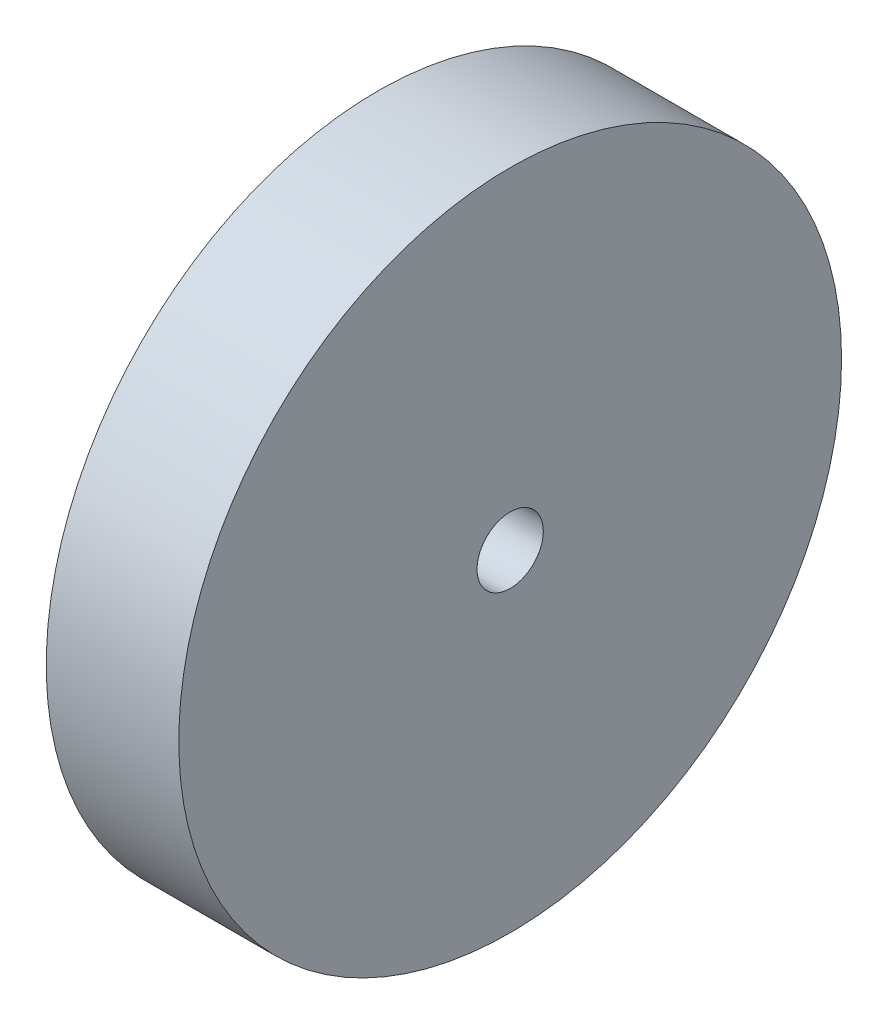
from build123d import *

# Parameters (mm, degrees)
SKETCH1_R           = 50
SKETCH1_R_2         = 5
BOSS_EXTRUDE1_DEPTH = 20


with BuildPart() as part:
    # Sketch1 → Boss-Extrude1 (new body)
    with BuildSketch(Plane(origin=(0, 0, 0), x_dir=(0, 0, -1), z_dir=(1, 0, 0))):
        Circle(SKETCH1_R)
        Circle(SKETCH1_R_2, mode=Mode.SUBTRACT)
    extrude(amount=BOSS_EXTRUDE1_DEPTH)


solid = part.part
